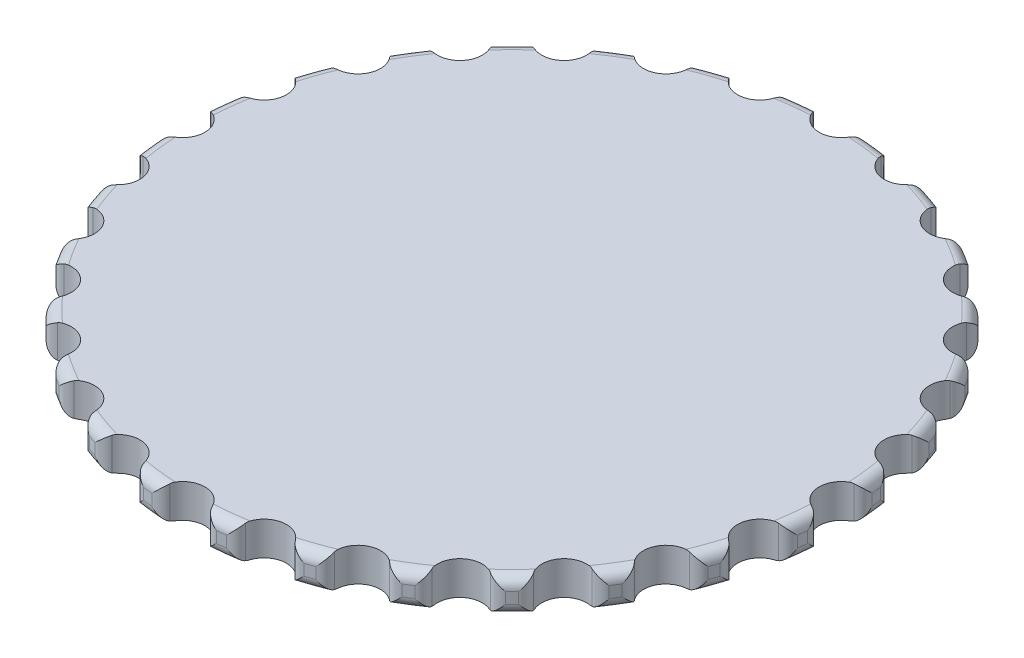
from build123d import *

# Parameters (mm, degrees)
SKETCH2_R           = 29.4
BOSS_EXTRUDE1_DEPTH = 3
SKETCH3_R           = 2
CUT_EXTRUDE1_DEPTH  = 3
CIRPATTERN1_COUNT   = 28
FILLET1_R           = 1


with BuildPart() as part:
    # Sketch2 → Boss-Extrude1 (new body)
    with BuildSketch(Plane(origin=(0, 0, 0), x_dir=(1, 0, 0), z_dir=(0, 1, 0))):
        with Locations(Location((0, 0, 0), (0, 0, 270))):
            Circle(SKETCH2_R)
    extrude(amount=BOSS_EXTRUDE1_DEPTH)

    # Sketch3 → Cut-Extrude1 (cut)
    with BuildSketch(Plane(origin=(0, 3, 0), x_dir=(1, 0, 0), z_dir=(0, 1, 0))):
        with Locations((0, 29.4)):
            Circle(SKETCH3_R)
    cut_extrude1 = extrude(amount=-CUT_EXTRUDE1_DEPTH, mode=Mode.SUBTRACT)

    # CirPattern1: Cut-Extrude1 ×28 about axis
    cirpattern1_axis = Axis((0, 0, 0), (0, 1, 0))
    for i in range(1, CIRPATTERN1_COUNT):
        add(cut_extrude1.rotate(cirpattern1_axis, i * 360 / CIRPATTERN1_COUNT), mode=Mode.SUBTRACT)

    # Fillet1
    fillet1_edges = [part.edges().sort_by_distance(p)[0] for p in [
        (-16.72542772, 1.5, -24.178917833),
        (-19.850944085, 1.5, -21.686401706),
        (-21.686401706, 1.5, -19.850944085),
        (-24.178917833, 1.5, -16.72542772),
        (-25.559928955, 1.5, -14.52756111),
        (-27.294459679, 1.5, -10.925770949),
        (-28.151774638, 1.5, -8.475705559),
        (-29.041343345, 1.5, -4.578250401),
        (-29.331972789, 1.5, -1.99884274),
        (-29.331972789, 1.5, 1.99884274),
        (-29.041343345, 1.5, 4.578250401),
        (-28.151774638, 1.5, 8.475705559),
        (-27.294459679, 1.5, 10.925770949),
        (-25.559928955, 1.5, 14.52756111),
        (-24.178917833, 1.5, 16.72542772),
        (-21.686401706, 1.5, 19.850944085),
        (-19.850944085, 1.5, 21.686401706),
        (-16.72542772, 1.5, 24.178917833),
        (-14.52756111, 1.5, 25.559928955),
        (-10.925770949, 1.5, 27.294459679),
        (-8.475705559, 1.5, 28.151774638),
        (-4.578250401, 1.5, 29.041343345),
        (-1.99884274, 1.5, 29.331972789),
        (1.99884274, 1.5, 29.331972789),
        (4.578250401, 1.5, 29.041343345),
        (8.475705559, 1.5, 28.151774638),
        (-9.710204421, 0, -27.750169911),
        (10.925770949, 1.5, 27.294459679),
        (14.52756111, 1.5, 25.559928955),
        (-15.64174305, 0, -24.893691457),
        (16.72542772, 1.5, 24.178917833),
        (19.850944085, 1.5, 21.686401706),
        (21.686401706, 1.5, 19.850944085),
        (24.178917833, 1.5, 16.72542772),
        (-20.788939367, 0, -20.788939367),
        (25.559928955, 1.5, 14.52756111),
        (27.294459679, 1.5, 10.925770949),
        (-24.893691457, 0, -15.64174305),
        (28.151774638, 1.5, 8.475705559),
        (29.041343345, 1.5, 4.578250401),
        (29.331972789, 1.5, 1.99884274),
        (29.331972789, 1.5, -1.99884274),
        (-27.750169911, 0, -9.710204421),
        (29.041343345, 1.5, -4.578250401),
        (28.151774638, 1.5, -8.475705559),
        (-29.215138971, 0, -3.291755597),
        (27.294459679, 1.5, -10.925770949),
        (25.559928955, 1.5, -14.52756111),
        (24.178917833, 1.5, -16.72542772),
        (21.686401706, 1.5, -19.850944085),
        (-29.215138971, 0, 3.291755597),
        (19.850944085, 1.5, -21.686401706),
        (16.72542772, 1.5, -24.178917833),
        (-27.750169911, 0, 9.710204421),
        (14.52756111, 1.5, -25.559928955),
        (10.925770949, 1.5, -27.294459679),
        (8.475705559, 1.5, -28.151774638),
        (4.578250401, 1.5, -29.041343345),
        (-24.893691457, 0, 15.64174305),
        (-4.578250401, 1.5, -29.041343345),
        (-8.475705559, 1.5, -28.151774638),
        (-20.788939367, 0, 20.788939367),
        (-15.64174305, 0, 24.893691457),
        (-9.710204421, 0, 27.750169911),
        (-3.291755597, 0, 29.215138971),
        (3.291755597, 0, 29.215138971),
        (9.710204421, 0, 27.750169911),
        (15.64174305, 0, 24.893691457),
        (20.788939367, 0, 20.788939367),
        (24.893691457, 0, 15.64174305),
        (27.750169911, 0, 9.710204421),
        (29.215138971, 0, 3.291755597),
        (29.215138971, 0, -3.291755597),
        (27.750169911, 0, -9.710204421),
        (24.893691457, 0, -15.64174305),
        (20.788939367, 0, -20.788939367),
        (15.64174305, 0, -24.893691457),
        (9.710204421, 0, -27.750169911),
        (3.291755597, 0, -29.215138971),
        (-9.710204421, 3, -27.750169911),
        (-15.64174305, 3, -24.893691457),
        (-20.788939367, 3, -20.788939367),
        (-24.893691457, 3, -15.64174305),
        (-27.750169911, 3, -9.710204421),
        (-29.215138971, 3, -3.291755597),
        (-29.215138971, 3, 3.291755597),
        (-27.750169911, 3, 9.710204421),
        (-24.893691457, 3, 15.64174305),
        (-20.788939367, 3, 20.788939367),
        (-15.64174305, 3, 24.893691457),
        (-9.710204421, 3, 27.750169911),
        (-3.291755597, 3, 29.215138971),
        (3.291755597, 3, 29.215138971),
        (9.710204421, 3, 27.750169911),
        (15.64174305, 3, 24.893691457),
        (20.788939367, 3, 20.788939367),
        (24.893691457, 3, 15.64174305),
        (27.750169911, 3, 9.710204421),
        (29.215138971, 3, 3.291755597),
        (29.215138971, 3, -3.291755597),
        (-3.291755597, 0, -29.215138971),
        (27.750169911, 3, -9.710204421),
        (24.893691457, 3, -15.64174305),
        (20.788939367, 3, -20.788939367),
        (15.64174305, 3, -24.893691457),
        (9.710204421, 3, -27.750169911),
        (3.291755597, 3, -29.215138971),
        (-3.291755597, 3, -29.215138971),
        (1.99884274, 1.5, -29.331972789),
        (-1.99884274, 1.5, -29.331972789),
        (-10.925770949, 1.5, -27.294459679),
        (-14.52756111, 1.5, -25.559928955),
    ]]
    fillet(fillet1_edges, radius=FILLET1_R)


solid = part.part
